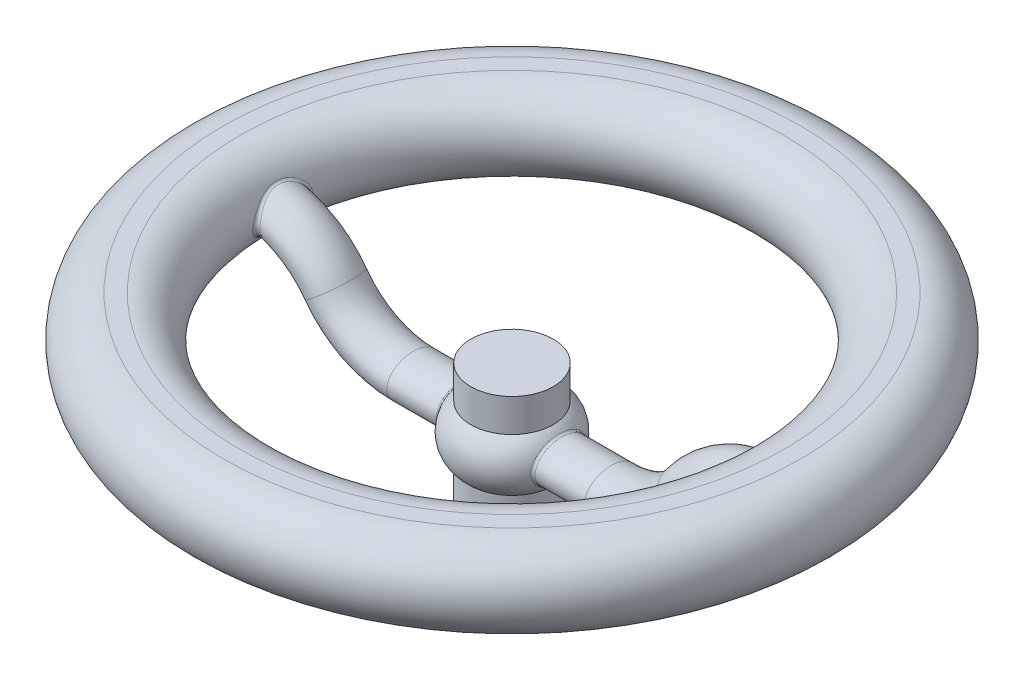
from build123d import *

# Parameters (mm, degrees)
SKETCH_4_RX                      = 8
SKETCH_4_RY                      = 6
FILLET_1_R                       = 1
PATTERN_CIRCULAR_1_COUNT         = 2
FILLET_1_OF_PATTERN_CIRCULAR_1_R = 1


with BuildPart() as part:
    # Эскиз1 → Повернуть1 (revolve)
    with BuildSketch(Plane.XY, mode=Mode.PRIVATE) as revolve_1_sk:
        with BuildLine():
            Line((-12.5, 35), (-12.5, 45))
            Line((-12.5, 45), (0, 45))
            Line((0, 45), (0, 0))
            Line((0, 0), (-12.5, 0))
            Line((-12.5, 0), (-12.5, 19))
            ThreePointArc((-12.5, 19), (-16.5, 27), (-12.5, 35))
        make_face()
    revolve(revolve_1_sk.sketch.rotate(Axis((0, 0, 0), (0, 1, 0)), 270), axis=Axis((0, 0, 0), (0, 1, 0)))



with BuildPart() as body_2:
    # Эскиз2 → Повернуть2 (revolve)
    with BuildSketch(Plane.XY, mode=Mode.PRIVATE) as revolve_2_sk:
        with BuildLine():
            Line((-87.5, 63.5), (-82.5, 63.5))
            ThreePointArc((-82.5, 63.5), (-70, 51), (-82.5, 38.5))
            Line((-82.5, 38.5), (-87.5, 38.5))
            ThreePointArc((-87.5, 38.5), (-100, 51), (-87.5, 63.5))
        make_face()
    revolve(revolve_2_sk.sketch.rotate(Axis((0, 0, 0), (0, 1, 0)), 270), axis=Axis((0, 0, 0), (0, 1, 0)))


with BuildPart() as part_1:
    add(part.part)

    add(body_2.part)  # По траектории1 merges body 2
    # По траектории1: sweep along a path in Эскиз3
    with BuildLine(Plane.XY) as sweep_1_path:
        Line((0, 27), (-30, 27))
        ThreePointArc((-30, 27), (-43.190905958, 30.17365686), (-53.494680249, 39))
        ThreePointArc((-53.494680249, 39), (-63.79845454, 47.82634314), (-76.989360498, 51))
        Line((-76.989360498, 51), (-85, 51))
    # Эскиз4 → По траектории1 (sweep)
    with BuildSketch(Plane(origin=(0, 0, 0), x_dir=(0, 0, -1), z_dir=(1, 0, 0))):
        with Locations((0, 27)):
            Ellipse(SKETCH_4_RX, SKETCH_4_RY)
    sweep_1 = sweep(path=sweep_1_path.line)

    # Скругление1
    fillet_1_edges = [part_1.edges().sort_by_distance(p)[0] for p in [
        (-14.43086969, 27.000000001, 8),
        (-69.555419623, 50.456444992, 7.981168691),
    ]]
    fillet(fillet_1_edges, radius=FILLET_1_R)

    # Круговой массив1: По траектории1 ×2 about axis
    pattern_circular_1_axis = Axis((0, 0, 0), (0, -1, 0))
    for i in range(1, PATTERN_CIRCULAR_1_COUNT):
        add(sweep_1.rotate(pattern_circular_1_axis, i * 360 / PATTERN_CIRCULAR_1_COUNT))

    # Скругление1 of Круговой массив1
    fillet_1_of_pattern_circular_1_edges = [part_1.edges().sort_by_distance(p)[0] for p in [
        (14.43086969, 27.000000001, -8),
        (69.555419623, 50.456444992, -7.981168691),
    ]]
    fillet(fillet_1_of_pattern_circular_1_edges, radius=FILLET_1_OF_PATTERN_CIRCULAR_1_R)


solid = part_1.part
